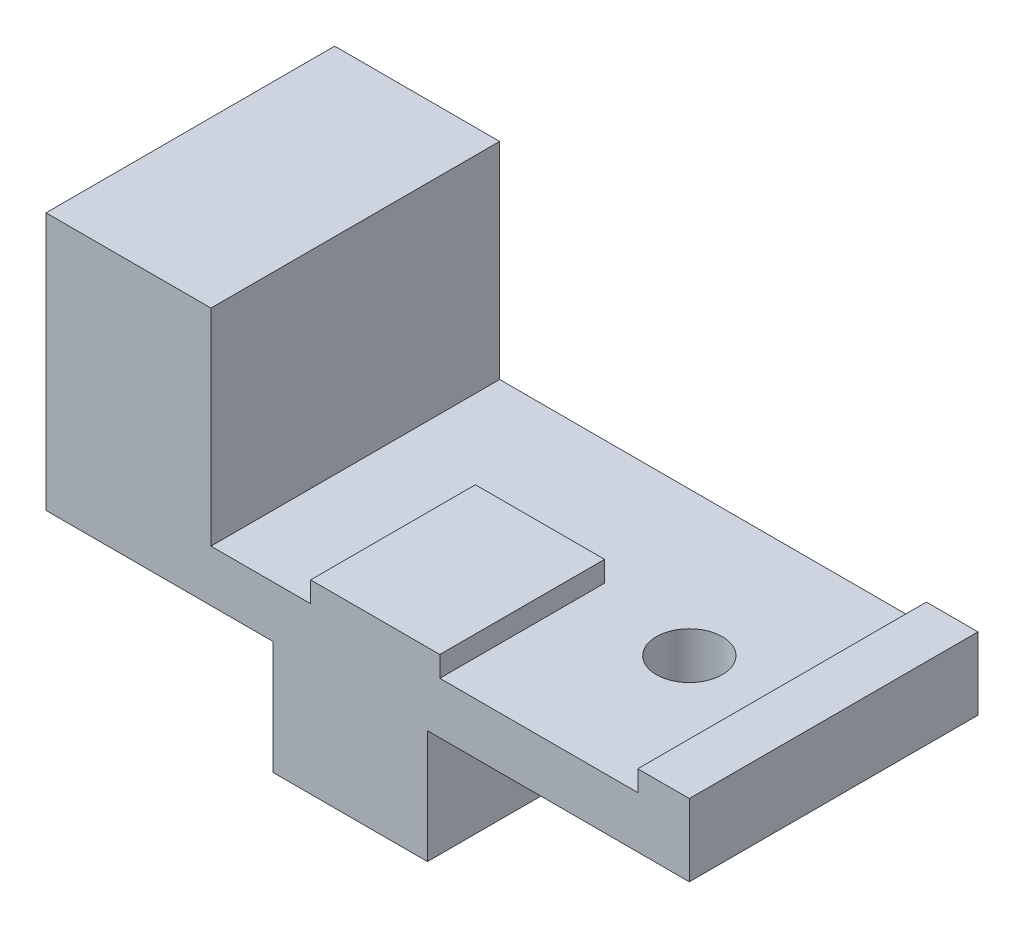
from build123d import *

# Parameters (mm, degrees)
SKETCH_1_W         = 31.2
SKETCH_1_H         = 14
EXTRUDE_1_DEPTH    = 2.5
SKETCH_2_W         = 8
SKETCH_2_H         = 14
EXTRUDE_2_DEPTH    = 10
SKETCH_3_W         = 7.5
SKETCH_3_H         = 7.5
EXTRUDE_3_DEPTH    = 5.5
HOLE_WIZARD_M3_1_D = 3.2
SKETCH_9_W         = 6.266652583
SKETCH_9_H         = 7.99110138
EXTRUDE_7_DEPTH    = 1
SKETCH_10_W        = 2.5
SKETCH_10_H        = 14
EXTRUDE_8_DEPTH    = 1


with BuildPart() as part:
    # 草图1 → 凸台-拉伸1 (new body)
    with BuildSketch(Plane(origin=(0, 0, 0), x_dir=(1, 0, 0), z_dir=(0, 1, 0))):
        Rectangle(SKETCH_1_W, SKETCH_1_H)
    extrude(amount=EXTRUDE_1_DEPTH)

    # 草图2 → 凸台-拉伸2 (add)
    with BuildSketch(Plane(origin=(0, 2.5, 0), x_dir=(1, 0, 0), z_dir=(0, 1, 0))):
        with Locations((-11.6, 0)):
            Rectangle(SKETCH_2_W, SKETCH_2_H)
    extrude(amount=EXTRUDE_2_DEPTH)

    # 草图3 → 凸台-拉伸3 (add)
    with BuildSketch(Plane.XZ):
        with Locations((-0.85, 3.25)):
            Rectangle(SKETCH_3_W, SKETCH_3_H)
    extrude(amount=EXTRUDE_3_DEPTH)

    # M3 间隙孔1 (through all)
    with Locations(Plane(origin=(0, 2.5, 0), x_dir=(1, 0, 0), z_dir=(0, 1, 0))):
        with Locations((8.6, 0)):
            Hole(HOLE_WIZARD_M3_1_D / 2)

    # 草图9 → 凸台-拉伸7 (add)
    with BuildSketch(Plane(origin=(0, 2.5, 0), x_dir=(1, 0, 0), z_dir=(0, 1, 0))):
        with Locations((0.366673708, -3.00444931)):
            Rectangle(SKETCH_9_W, SKETCH_9_H)
    extrude(amount=EXTRUDE_7_DEPTH)

    # 草图10 → 凸台-拉伸8 (add)
    with BuildSketch(Plane.XZ.offset(-2.5)):
        with Locations((14.35, 0)):
            Rectangle(SKETCH_10_W, SKETCH_10_H)
    extrude(amount=-EXTRUDE_8_DEPTH)


solid = part.part
